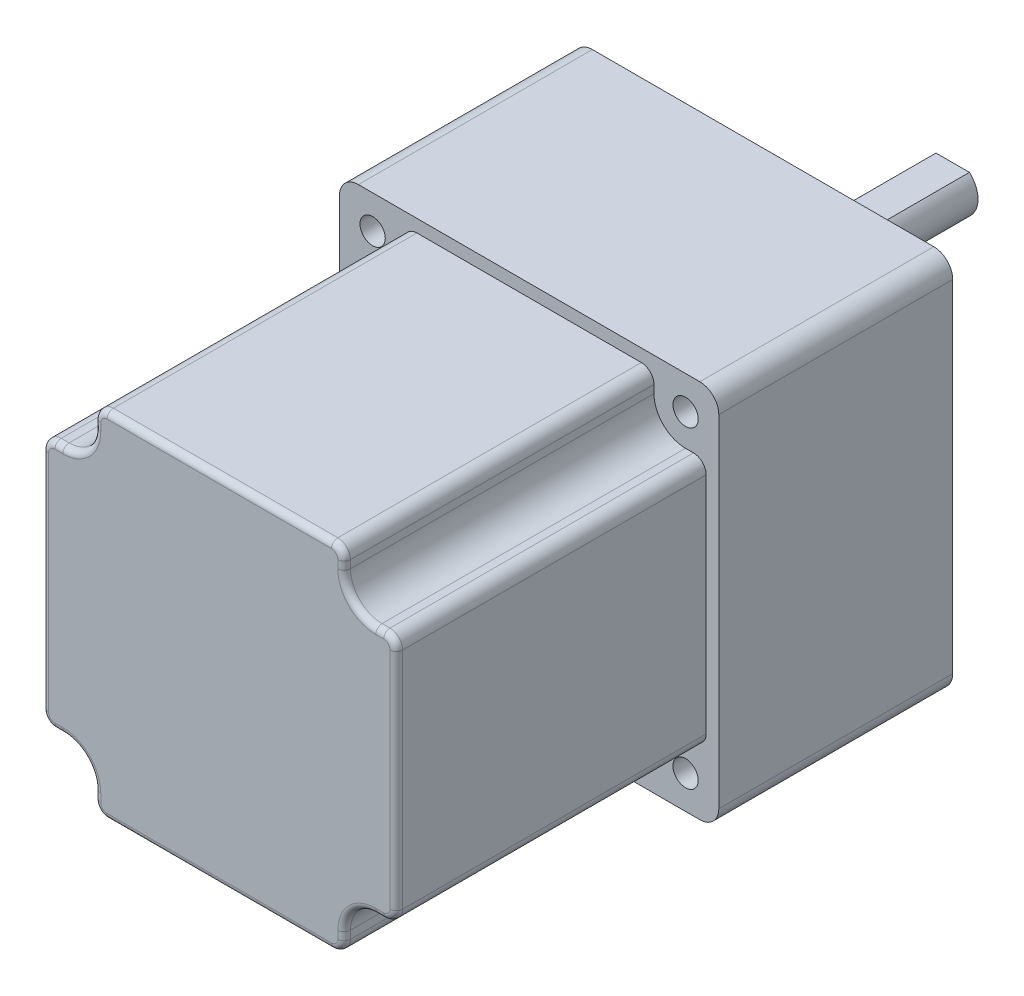
from build123d import *

# Parameters (mm, degrees)
SKETCH_1_W          = 60
SKETCH_1_H          = 60
EXTRUDE_1_DEPTH     = 37
SKETCH_2_W          = 56
SKETCH_2_H          = 56
EXTRUDE_2_DEPTH     = 49
CUT_EXTRUDE_1_DEPTH = 49
SKETCH_4_R          = 2
CUT_EXTRUDE_2_DEPTH = 49
FILLET_1_R          = 2
SKETCH_5_R          = 27
CUT_EXTRUDE_3_DEPTH = 1
SKETCH_6_R          = 12
EXTRUDE_3_DEPTH     = 4
SKETCH_7_R          = 4
EXTRUDE_4_DEPTH     = 27
SKETCH_8_W          = 5.291502622
SKETCH_8_H          = 3.956308335
CUT_EXTRUDE_4_DEPTH = 27
FILLET_2_R          = 1
FILLET_3_R          = 3


with BuildPart() as part:
    # Эскиз1 → Бобышка-Вытянуть1 (new body)
    with BuildSketch(Plane.XY):
        with Locations((0.572032188, -6.927630122)):
            Rectangle(SKETCH_1_W, SKETCH_1_H)
    extrude(amount=EXTRUDE_1_DEPTH)

    # Эскиз2 → Бобышка-Вытянуть2 (add)
    with BuildSketch(Plane.XY.offset(37)):
        with Locations((0.572032188, -6.927630122)):
            Rectangle(SKETCH_2_W, SKETCH_2_H)
    extrude(amount=EXTRUDE_2_DEPTH)

    # Эскиз3 → Вырез-Вытянуть1 (cut)
    with BuildSketch(Plane.XY.offset(86)):
        with BuildLine():
            Line((-19.176705154, 17.82110722), (-19.176705154, 21.072369878))
            Line((-19.176705154, 21.072369878), (-27.427967812, 21.072369878))
            Line((-27.427967812, 21.072369878), (-27.427967812, 12.82110722))
            Line((-27.427967812, 12.82110722), (-24.176705154, 12.82110722))
            ThreePointArc((-24.176705154, 12.82110722), (-20.641171248, 14.285573314), (-19.176705154, 17.82110722))
        make_face()
        with BuildLine():
            Line((20.32076953, 17.82110722), (20.32076953, 21.072369878))
            Line((20.32076953, 21.072369878), (28.572032188, 21.072369878))
            Line((28.572032188, 21.072369878), (28.572032188, 12.82110722))
            Line((28.572032188, 12.82110722), (25.32076953, 12.82110722))
            ThreePointArc((25.32076953, 12.82110722), (21.785235624, 14.285573314), (20.32076953, 17.82110722))
        make_face()
        with BuildLine():
            Line((-24.176705154, -26.676367463), (-27.427967812, -26.676367463))
            Line((-27.427967812, -26.676367463), (-27.427967812, -34.927630122))
            Line((-27.427967812, -34.927630122), (-19.176705154, -34.927630122))
            Line((-19.176705154, -34.927630122), (-19.176705154, -31.676367463))
            ThreePointArc((-19.176705154, -31.676367463), (-20.641171248, -28.140833557), (-24.176705154, -26.676367463))
        make_face()
        with BuildLine():
            Line((25.32076953, -26.676367463), (28.572032188, -26.676367463))
            Line((28.572032188, -26.676367463), (28.572032188, -34.927630122))
            Line((28.572032188, -34.927630122), (20.32076953, -34.927630122))
            Line((20.32076953, -34.927630122), (20.32076953, -31.676367463))
            ThreePointArc((20.32076953, -31.676367463), (21.785235624, -28.140833557), (25.32076953, -26.676367463))
        make_face()
    extrude(amount=-CUT_EXTRUDE_1_DEPTH, mode=Mode.SUBTRACT)

    # Эскиз4 → Вырез-Вытянуть2 (cut)
    with BuildSketch(Plane.XY.offset(37)):
        with Locations((-24.176705154, 17.82110722)):
            Circle(SKETCH_4_R)
        with Locations((25.32076953, 17.82110722)):
            Circle(SKETCH_4_R)
        with Locations((-24.176705154, -31.676367463)):
            Circle(SKETCH_4_R)
        with Locations((25.32076953, -31.676367463)):
            Circle(SKETCH_4_R)
    extrude(amount=-CUT_EXTRUDE_2_DEPTH, mode=Mode.SUBTRACT)

    # Скругление1
    fillet_1_edges = [part.edges().sort_by_distance(p)[0] for p in [
        (-19.176705154, 21.072369878, 61.5),
        (-27.427967812, 12.82110722, 61.5),
        (28.572032188, 12.82110722, 61.5),
        (20.32076953, 21.072369878, 61.5),
        (-19.176705154, -34.927630122, 61.5),
        (-27.427967812, -26.676367463, 61.5),
        (28.572032188, -26.676367463, 61.5),
        (20.32076953, -34.927630122, 61.5),
    ]]
    fillet(fillet_1_edges, radius=FILLET_1_R)

    # Эскиз5 → Вырез-Вытянуть3 (cut)
    with BuildSketch(Plane(origin=(0, 0, 0), x_dir=(-1, 0, 0), z_dir=(0, 0, -1))):
        with Locations((-0.572032188, -6.927630122)):
            Circle(SKETCH_5_R)
    extrude(amount=-CUT_EXTRUDE_3_DEPTH, mode=Mode.SUBTRACT)

    # Эскиз6 → Бобышка-Вытянуть3 (add)
    with BuildSketch(Plane(origin=(0, 0, 1), x_dir=(-1, 0, 0), z_dir=(0, 0, -1))):
        with Locations((-0.572032188, 3.072369878)):
            Circle(SKETCH_6_R)
    extrude(amount=EXTRUDE_3_DEPTH)

    # Эскиз7 → Бобышка-Вытянуть4 (add)
    with BuildSketch(Plane(origin=(0, 0, -3), x_dir=(-1, 0, 0), z_dir=(0, 0, -1))):
        with Locations((-0.572032188, 3.072369878)):
            Circle(SKETCH_7_R)
    extrude(amount=EXTRUDE_4_DEPTH)

    # Эскиз8 → Вырез-Вытянуть4 (cut)
    with BuildSketch(Plane(origin=(0, 0, -30), x_dir=(-1, 0, 0), z_dir=(0, 0, -1))):
        with Locations((-0.572032188, 8.050524046)):
            Rectangle(SKETCH_8_W, SKETCH_8_H)
    extrude(amount=-CUT_EXTRUDE_4_DEPTH, mode=Mode.SUBTRACT)

    # Скругление2
    fillet_2_edges = [part.edges().sort_by_distance(p)[0] for p in [
        (28.572032188, -6.927630122, 86),
        (25.946400859, -26.676367463, 86),
        (20.32076953, 18.446738549, 86),
        (0.572032188, 21.072369878, 86),
        (-24.802336483, 12.82110722, 86),
        (-27.427967812, -6.927630122, 86),
        (-19.176705154, -32.301998793, 86),
        (0.572032188, -34.927630122, 86),
        (-26.842181374, 12.235320782, 86),
        (-18.590918716, 20.486583441, 86),
        (-26.842181374, -26.090581026, 86),
        (-18.590918716, -34.341843684, 86),
        (19.734983092, -34.341843684, 86),
        (27.98624575, -26.090581026, 86),
        (19.734983092, 20.486583441, 86),
        (27.98624575, 12.235320782, 86),
        (-20.641171248, 14.285573314, 86),
        (-19.176705154, 18.446738549, 86),
        (21.785235624, 14.285573314, 86),
        (25.946400859, 12.82110722, 86),
        (-20.641171248, -28.140833557, 86),
        (-24.802336483, -26.676367463, 86),
        (21.785235624, -28.140833557, 86),
        (20.32076953, -32.301998793, 86),
    ]]
    fillet(fillet_2_edges, radius=FILLET_2_R)

    # Скругление3
    fillet_3_edges = [part.edges().sort_by_distance(p)[0] for p in [
        (-29.427967812, 23.072369878, 18.5),
        (30.572032188, 23.072369878, 18.5),
        (30.572032188, -36.927630122, 18.5),
        (-29.427967812, -36.927630122, 18.5),
    ]]
    fillet(fillet_3_edges, radius=FILLET_3_R)


solid = part.part
